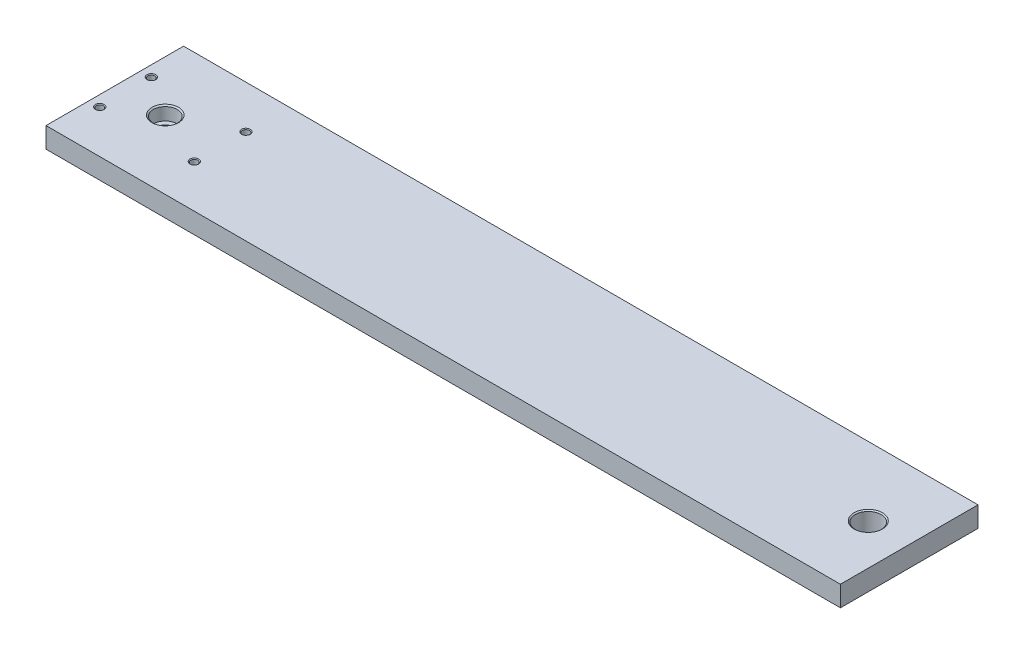
from build123d import *

# Parameters (mm, degrees)
SKETCH1_W                                = 369.57380619
SKETCH1_H                                = 64
BOSS_EXTRUDE1_DEPTH                      = 9.525
F_15_32_0_475_DIAMETER_HOLE1_D           = 12.065
F_15_32_0_475_DIAMETER_HOLE1_DEPTH       = 10.1092
F_15_32_0_475_DIAMETER_HOLE1_CSINK_D     = 13.17625
F_15_32_0_475_DIAMETER_HOLE1_CSINK_ANGLE = 100
F_15_32_0_475_DIAMETER_HOLE1_TIP         = 3.624691684
M4X0_7_TAPPED_HOLE1_D                    = 3.3
M4X0_7_TAPPED_HOLE1_CSINK_D              = 4.05
M4X0_7_TAPPED_HOLE1_CSINK_ANGLE          = 100


with BuildPart() as part:
    # Sketch1 → Boss-Extrude1 (new body)
    with BuildSketch(Plane(origin=(0, 0, 0), x_dir=(1, 0, 0), z_dir=(0, 1, 0))):
        with Locations((184.786903095, 32)):
            Rectangle(SKETCH1_W, SKETCH1_H)
    extrude(amount=BOSS_EXTRUDE1_DEPTH)

    # 15/32 (0.475) Diameter Hole1
    with Locations(Plane(origin=(0, 9.525, 0), x_dir=(1, 0, 0), z_dir=(0, 1, 0))):
        with Locations((350.52380619, 32)):
            CounterSinkHole(F_15_32_0_475_DIAMETER_HOLE1_D / 2, F_15_32_0_475_DIAMETER_HOLE1_CSINK_D / 2, depth=F_15_32_0_475_DIAMETER_HOLE1_DEPTH, counter_sink_angle=F_15_32_0_475_DIAMETER_HOLE1_CSINK_ANGLE)
            with Locations((0, 0, -(F_15_32_0_475_DIAMETER_HOLE1_DEPTH + F_15_32_0_475_DIAMETER_HOLE1_TIP / 2))):  # 118° drill point
                Cone(0, F_15_32_0_475_DIAMETER_HOLE1_D / 2, F_15_32_0_475_DIAMETER_HOLE1_TIP, mode=Mode.SUBTRACT)

    # M4x0.7 Tapped Hole1 (through all)
    with Locations(Plane(origin=(0, 9.525, 0), x_dir=(1, 0, 0), z_dir=(0, 1, 0))):
        with Locations((49, 44), (49, 20), (5, 44), (5, 20)):
            CounterSinkHole(M4X0_7_TAPPED_HOLE1_D / 2, M4X0_7_TAPPED_HOLE1_CSINK_D / 2, counter_sink_angle=M4X0_7_TAPPED_HOLE1_CSINK_ANGLE)

    # Sketch11 → CBORE for 1/4 Socket Head Cap Screw1 (revolve, cut)
    with BuildSketch(Plane(origin=(23.5, 9.525, -32), x_dir=(0, 0, 1), z_dir=(1, 0, 0))):
        Polygon((0, 0), (0, 9.525), (3.3782, 9.525), (3.3782, 6.35), (5.55625, 6.35), (5.55625, 0.532828266), (6.19125, 0), align=None)
    revolve(axis=Axis((23.5, 15.875, -32), (0, -1, 0)), mode=Mode.SUBTRACT)


solid = part.part
